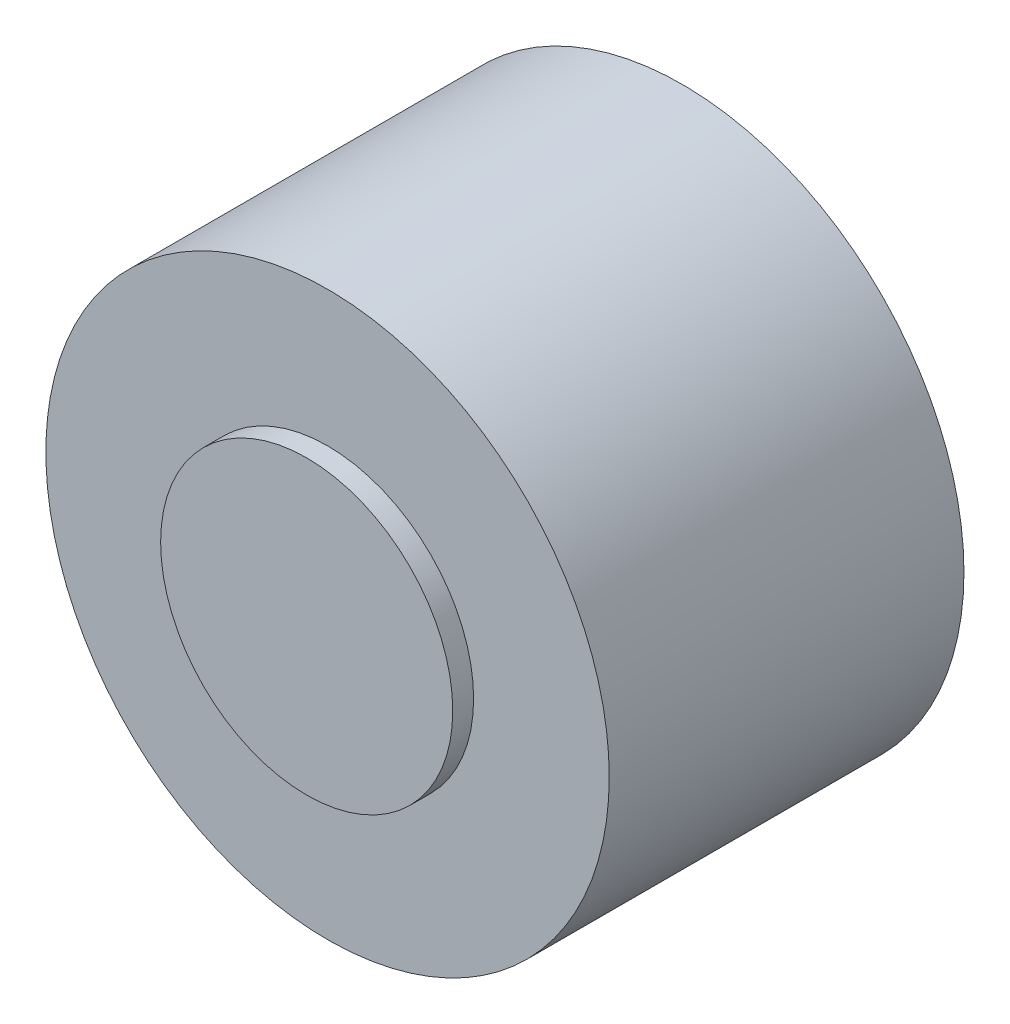
from build123d import *

# Parameters (mm, degrees)
SKETCH_1_R      = 13.5
EXTRUDE_1_DEPTH = 17
SKETCH_2_R      = 7
EXTRUDE_2_DEPTH = 1


with BuildPart() as part:
    # Эскиз1 → Бобышка-Вытянуть1 (new body)
    with BuildSketch(Plane.XY):
        Circle(SKETCH_1_R)
    extrude(amount=EXTRUDE_1_DEPTH)

    # Эскиз2 → Бобышка-Вытянуть2 (add)
    with BuildSketch(Plane.XY.offset(17)):
        Circle(SKETCH_2_R)
    extrude(amount=EXTRUDE_2_DEPTH)


solid = part.part
